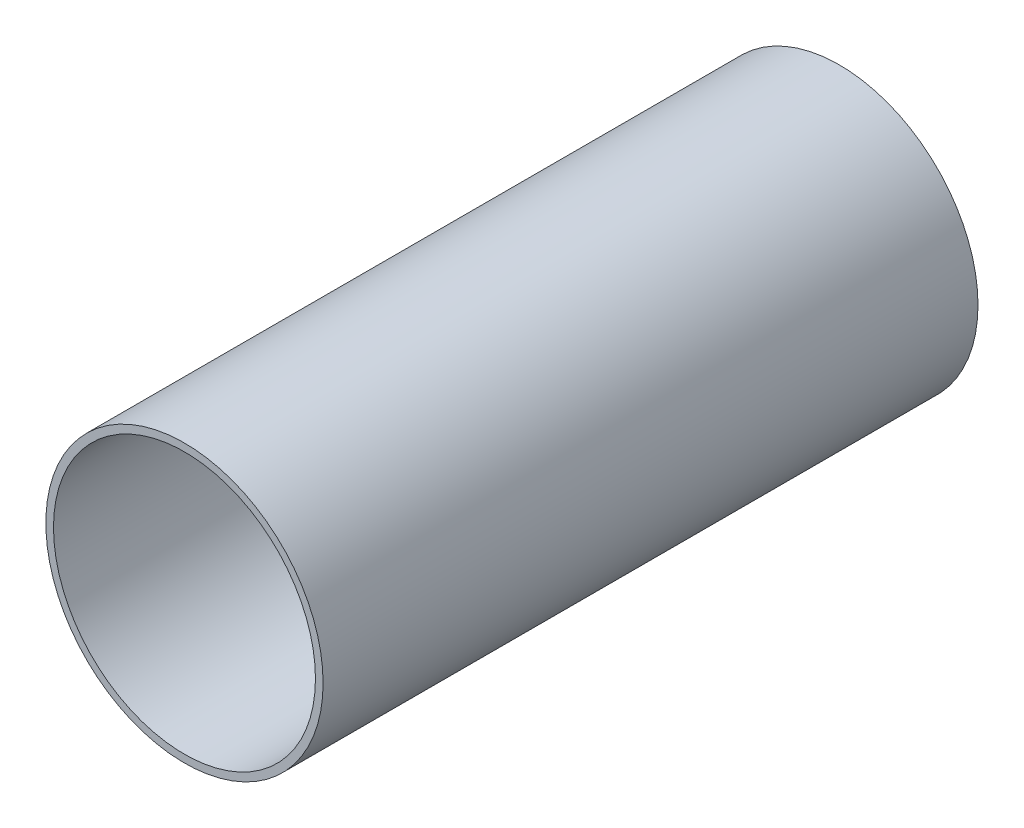
from build123d import *

# Parameters (mm, degrees)
SKETCH1_R           = 6.35
SKETCH1_R_2         = 6
BOSS_EXTRUDE1_DEPTH = 30


with BuildPart() as part:
    # Sketch1 → Boss-Extrude1 (new body)
    with BuildSketch(Plane.XY):
        Circle(SKETCH1_R)
        Circle(SKETCH1_R_2, mode=Mode.SUBTRACT)
    extrude(amount=BOSS_EXTRUDE1_DEPTH)


solid = part.part
